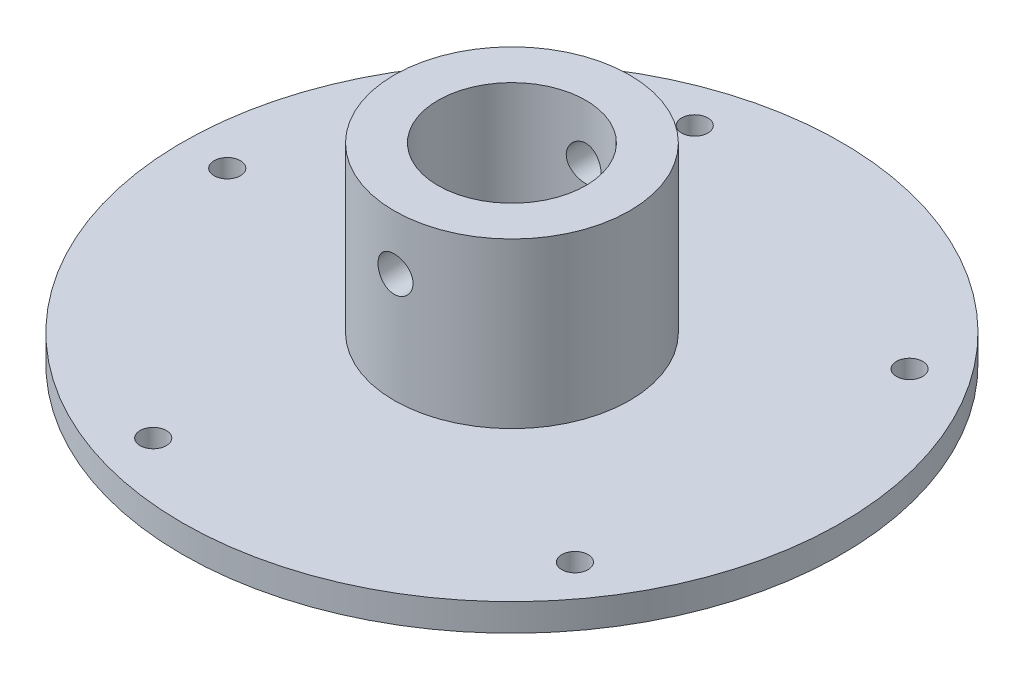
from build123d import *

# Parameters (mm, degrees)
SKETCH1_R               = 30.1
SKETCH1_R_2             = 1.2
SKETCH1_R_3             = 6.75
BOSS_EXTRUDE1_DEPTH     = 2.5
SKETCH2_R               = 10.75
SKETCH2_R_2             = 6.75
BOSS_EXTRUDE2_DEPTH     = 15
CUT_EXTRUDE1_DEPTH      = 47.024667299
CUT_EXTRUDE1_DEPTH_BACK = 47.024667299
SKETCH3_R               = 1.6


with BuildPart() as part:
    # Sketch1 → Boss-Extrude1 (new body)
    with BuildSketch(Plane(origin=(0, 0, 0), x_dir=(1, 0, 0), z_dir=(0, 1, 0))):
        with Locations(Location((0, 0, 0), (0, 0, 270))):
            Circle(SKETCH1_R)
        with Locations(Location((-26, 0, 0), (0, 0, 270))):
            Circle(SKETCH1_R_2, mode=Mode.SUBTRACT)
        with Locations(Location((-8.034441854, 24.727469424, 0), (0, 0, 270))):
            Circle(SKETCH1_R_2, mode=Mode.SUBTRACT)
        with Locations(Location((21.034441854, 15.28241656, 0), (0, 0, 270))):
            Circle(SKETCH1_R_2, mode=Mode.SUBTRACT)
        with Locations(Location((21.034441854, -15.28241656, 0), (0, 0, 270))):
            Circle(SKETCH1_R_2, mode=Mode.SUBTRACT)
        with Locations(Location((-8.034441854, -24.727469424, 0), (0, 0, 270))):
            Circle(SKETCH1_R_2, mode=Mode.SUBTRACT)
        with Locations(Location((0, 0, 0), (0, 0, 270))):
            Circle(SKETCH1_R_3, mode=Mode.SUBTRACT)
    extrude(amount=BOSS_EXTRUDE1_DEPTH)

    # Sketch2 → Boss-Extrude2 (add)
    with BuildSketch(Plane(origin=(0, 2.5, 0), x_dir=(1, 0, 0), z_dir=(0, 1, 0))):
        with Locations(Location((0, 0, 0), (0, 0, 270))):
            Circle(SKETCH2_R)
        with Locations(Location((0, 0, 0), (0, 0, 270))):
            Circle(SKETCH2_R_2, mode=Mode.SUBTRACT)
    extrude(amount=BOSS_EXTRUDE2_DEPTH)

    # Sketch3 → Cut-Extrude1 (cut, two sides: drawn at the far end of the back side and taken through both)
    with BuildSketch(Plane.XY.offset(-CUT_EXTRUDE1_DEPTH_BACK)):
        with Locations((0, 12.5)):
            Circle(SKETCH3_R)
    extrude(amount=CUT_EXTRUDE1_DEPTH + CUT_EXTRUDE1_DEPTH_BACK, mode=Mode.SUBTRACT)


solid = part.part
